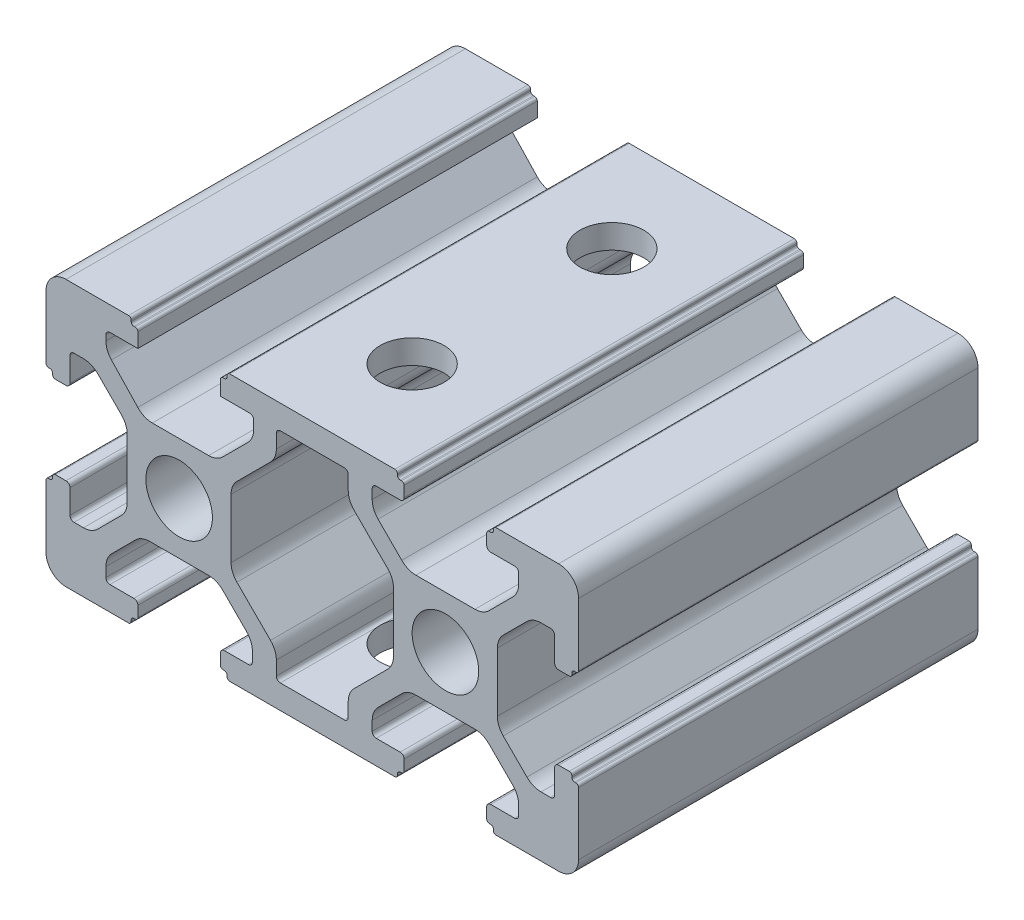
from build123d import *

# Parameters (mm, degrees)
SKETCH1_R           = 2.5
BOSS_EXTRUDE2_DEPTH = 30
SKETCH2_R           = 2.4
CUT_EXTRUDE1_DEPTH  = 28
SKETCH4_R           = 1.45
CUT_EXTRUDE2_DEPTH  = 70


with BuildPart() as part:
    # Sketch1 → Boss-Extrude2 (new body)
    with BuildSketch(Plane.XY):
        with BuildLine():
            Line((1.5, 0), (6.2, 0))
            ThreePointArc((6.2, 0), (6.341421356, 0.058578644), (6.4, 0.2))
            Line((6.4, 0.2), (6.4, 0.3))
            ThreePointArc((6.4, 0.3), (6.458578644, 0.441421356), (6.6, 0.5))
            Line((6.6, 0.5), (6.7, 0.5))
            ThreePointArc((6.7, 0.5), (6.841421356, 0.558578644), (6.9, 0.7))
            Line((6.9, 0.7), (6.9, 1.5))
            ThreePointArc((6.9, 1.5), (6.812132034, 1.712132034), (6.6, 1.8))
            Line((6.6, 1.8), (4.8, 1.8))
            ThreePointArc((4.8, 1.8), (4.587867966, 1.887867966), (4.5, 2.1))
            Line((4.5, 2.1), (4.5, 2.818019485))
            ThreePointArc((4.5, 2.818019485), (4.614180701, 3.392044633), (4.939339828, 3.878679656))
            Line((4.939339828, 3.878679656), (6.721320344, 5.660660172))
            ThreePointArc((6.721320344, 5.660660172), (7.207955367, 5.985819299), (7.781980515, 6.1))
            Line((7.781980515, 6.1), (12.218019485, 6.1))
            ThreePointArc((12.218019485, 6.1), (12.792044633, 5.985819299), (13.278679656, 5.660660172))
            Line((13.278679656, 5.660660172), (15.060660172, 3.878679656))
            ThreePointArc((15.060660172, 3.878679656), (15.385819299, 3.392044633), (15.5, 2.818019485))
            Line((15.5, 2.818019485), (15.5, 2.1))
            ThreePointArc((15.5, 2.1), (15.412132034, 1.887867966), (15.2, 1.8))
            Line((15.2, 1.8), (13.4, 1.8))
            ThreePointArc((13.4, 1.8), (13.187867966, 1.712132034), (13.1, 1.5))
            Line((13.1, 1.5), (13.1, 0.7))
            ThreePointArc((13.1, 0.7), (13.158578644, 0.558578644), (13.3, 0.5))
            Line((13.3, 0.5), (13.4, 0.5))
            ThreePointArc((13.4, 0.5), (13.541421356, 0.441421356), (13.6, 0.3))
            Line((13.6, 0.3), (13.6, 0.2))
            ThreePointArc((13.6, 0.2), (13.658578644, 0.058578644), (13.8, 0))
            Line((13.8, 0), (26.2, 0))
            ThreePointArc((26.2, 0), (26.341421356, 0.058578644), (26.4, 0.2))
            Line((26.4, 0.2), (26.4, 0.3))
            ThreePointArc((26.4, 0.3), (26.458578644, 0.441421356), (26.6, 0.5))
            Line((26.6, 0.5), (26.7, 0.5))
            ThreePointArc((26.7, 0.5), (26.841421356, 0.558578644), (26.9, 0.7))
            Line((26.9, 0.7), (26.9, 1.5))
            ThreePointArc((26.9, 1.5), (26.812132034, 1.712132034), (26.6, 1.8))
            Line((26.6, 1.8), (24.8, 1.8))
            ThreePointArc((24.8, 1.8), (24.587867966, 1.887867966), (24.5, 2.1))
            Line((24.5, 2.1), (24.5, 2.818019485))
            ThreePointArc((24.5, 2.818019485), (24.614180701, 3.392044633), (24.939339828, 3.878679656))
            Line((24.939339828, 3.878679656), (26.721320344, 5.660660172))
            ThreePointArc((26.721320344, 5.660660172), (27.207955367, 5.985819299), (27.781980515, 6.1))
            Line((27.781980515, 6.1), (32.218019485, 6.1))
            ThreePointArc((32.218019485, 6.1), (32.792044633, 5.985819299), (33.278679656, 5.660660172))
            Line((33.278679656, 5.660660172), (35.060660172, 3.878679656))
            ThreePointArc((35.060660172, 3.878679656), (35.385819299, 3.392044633), (35.5, 2.818019485))
            Line((35.5, 2.818019485), (35.5, 2.1))
            ThreePointArc((35.5, 2.1), (35.412132034, 1.887867966), (35.2, 1.8))
            Line((35.2, 1.8), (33.4, 1.8))
            ThreePointArc((33.4, 1.8), (33.187867966, 1.712132034), (33.1, 1.5))
            Line((33.1, 1.5), (33.1, 0.7))
            ThreePointArc((33.1, 0.7), (33.158578644, 0.558578644), (33.3, 0.5))
            Line((33.3, 0.5), (33.4, 0.5))
            ThreePointArc((33.4, 0.5), (33.541421356, 0.441421356), (33.6, 0.3))
            Line((33.6, 0.3), (33.6, 0.2))
            ThreePointArc((33.6, 0.2), (33.658578644, 0.058578644), (33.8, 0))
            Line((33.8, 0), (38.5, 0))
            ThreePointArc((38.5, 0), (39.560660172, 0.439339828), (40, 1.5))
            Line((40, 1.5), (40, 6.2))
            ThreePointArc((40, 6.2), (39.941421356, 6.341421356), (39.8, 6.4))
            Line((39.8, 6.4), (39.7, 6.4))
            ThreePointArc((39.7, 6.4), (39.558578644, 6.458578644), (39.5, 6.6))
            Line((39.5, 6.6), (39.5, 6.7))
            ThreePointArc((39.5, 6.7), (39.441421356, 6.841421356), (39.3, 6.9))
            Line((39.3, 6.9), (38.5, 6.9))
            ThreePointArc((38.5, 6.9), (38.287867966, 6.812132034), (38.2, 6.6))
            Line((38.2, 6.6), (38.2, 4.8))
            ThreePointArc((38.2, 4.8), (38.112132034, 4.587867966), (37.9, 4.5))
            Line((37.9, 4.5), (37.181980515, 4.5))
            ThreePointArc((37.181980515, 4.5), (36.607955367, 4.614180701), (36.121320344, 4.939339828))
            Line((36.121320344, 4.939339828), (34.339339828, 6.721320344))
            ThreePointArc((34.339339828, 6.721320344), (34.014180701, 7.207955367), (33.9, 7.781980515))
            Line((33.9, 7.781980515), (33.9, 12.218019485))
            ThreePointArc((33.9, 12.218019485), (34.014180701, 12.792044633), (34.339339828, 13.278679656))
            Line((34.339339828, 13.278679656), (36.121320344, 15.060660172))
            ThreePointArc((36.121320344, 15.060660172), (36.607955367, 15.385819299), (37.181980515, 15.5))
            Line((37.181980515, 15.5), (37.9, 15.5))
            ThreePointArc((37.9, 15.5), (38.112132034, 15.412132034), (38.2, 15.2))
            Line((38.2, 15.2), (38.2, 13.4))
            ThreePointArc((38.2, 13.4), (38.287867966, 13.187867966), (38.5, 13.1))
            Line((38.5, 13.1), (39.3, 13.1))
            ThreePointArc((39.3, 13.1), (39.441421356, 13.158578644), (39.5, 13.3))
            Line((39.5, 13.3), (39.5, 13.4))
            ThreePointArc((39.5, 13.4), (39.558578644, 13.541421356), (39.7, 13.6))
            Line((39.7, 13.6), (39.8, 13.6))
            ThreePointArc((39.8, 13.6), (39.941421356, 13.658578644), (40, 13.8))
            Line((40, 13.8), (40, 18.5))
            ThreePointArc((40, 18.5), (39.560660172, 19.560660172), (38.5, 20))
            Line((38.5, 20), (33.8, 20))
            ThreePointArc((33.8, 20), (33.658578644, 19.941421356), (33.6, 19.8))
            Line((33.6, 19.8), (33.6, 19.7))
            ThreePointArc((33.6, 19.7), (33.541421356, 19.558578644), (33.4, 19.5))
            Line((33.4, 19.5), (33.3, 19.5))
            ThreePointArc((33.3, 19.5), (33.158578644, 19.441421356), (33.1, 19.3))
            Line((33.1, 19.3), (33.1, 18.5))
            ThreePointArc((33.1, 18.5), (33.187867966, 18.287867966), (33.4, 18.2))
            Line((33.4, 18.2), (35.2, 18.2))
            ThreePointArc((35.2, 18.2), (35.412132034, 18.112132034), (35.5, 17.9))
            Line((35.5, 17.9), (35.5, 17.181980515))
            ThreePointArc((35.5, 17.181980515), (35.385819299, 16.607955367), (35.060660172, 16.121320344))
            Line((35.060660172, 16.121320344), (33.278679656, 14.339339828))
            ThreePointArc((33.278679656, 14.339339828), (32.792044633, 14.014180701), (32.218019485, 13.9))
            Line((32.218019485, 13.9), (27.781980515, 13.9))
            ThreePointArc((27.781980515, 13.9), (27.207955367, 14.014180701), (26.721320344, 14.339339828))
            Line((26.721320344, 14.339339828), (24.939339828, 16.121320344))
            ThreePointArc((24.939339828, 16.121320344), (24.614180701, 16.607955367), (24.5, 17.181980515))
            Line((24.5, 17.181980515), (24.5, 17.9))
            ThreePointArc((24.5, 17.9), (24.587867966, 18.112132034), (24.8, 18.2))
            Line((24.8, 18.2), (26.6, 18.2))
            ThreePointArc((26.6, 18.2), (26.812132034, 18.287867966), (26.9, 18.5))
            Line((26.9, 18.5), (26.9, 19.3))
            ThreePointArc((26.9, 19.3), (26.841421356, 19.441421356), (26.7, 19.5))
            Line((26.7, 19.5), (26.6, 19.5))
            ThreePointArc((26.6, 19.5), (26.458578644, 19.558578644), (26.4, 19.7))
            Line((26.4, 19.7), (26.4, 19.8))
            ThreePointArc((26.4, 19.8), (26.341421356, 19.941421356), (26.2, 20))
            Line((26.2, 20), (13.8, 20))
            ThreePointArc((13.8, 20), (13.658578644, 19.941421356), (13.6, 19.8))
            Line((13.6, 19.8), (13.6, 19.7))
            ThreePointArc((13.6, 19.7), (13.541421356, 19.558578644), (13.4, 19.5))
            Line((13.4, 19.5), (13.3, 19.5))
            ThreePointArc((13.3, 19.5), (13.158578644, 19.441421356), (13.1, 19.3))
            Line((13.1, 19.3), (13.1, 18.2))
            Line((13.1, 18.2), (15.3, 18.2))
            ThreePointArc((15.3, 18.2), (15.512132034, 18.112132034), (15.6, 17.9))
            Line((15.6, 17.9), (15.6, 17.281980515))
            ThreePointArc((15.6, 17.281980515), (15.485819299, 16.707955367), (15.160660172, 16.221320344))
            Line((15.160660172, 16.221320344), (13.278679656, 14.339339828))
            ThreePointArc((13.278679656, 14.339339828), (12.792044633, 14.014180701), (12.218019485, 13.9))
            Line((12.218019485, 13.9), (7.986375635, 13.9))
            ThreePointArc((7.986375635, 13.9), (7.393381044, 14.022191082), (6.896997987, 14.36885678))
            Line((6.896997987, 14.36885678), (4.910622352, 16.467414163))
            ThreePointArc((4.910622352, 16.467414163), (4.606431474, 16.943609851), (4.5, 17.498557383))
            Line((4.5, 17.498557383), (4.5, 17.9))
            ThreePointArc((4.5, 17.9), (4.587867966, 18.112132034), (4.8, 18.2))
            Line((4.8, 18.2), (6.9, 18.2))
            Line((6.9, 18.2), (6.9, 19.3))
            ThreePointArc((6.9, 19.3), (6.841421356, 19.441421356), (6.7, 19.5))
            Line((6.7, 19.5), (6.6, 19.5))
            ThreePointArc((6.6, 19.5), (6.458578644, 19.558578644), (6.4, 19.7))
            Line((6.4, 19.7), (6.4, 19.8))
            ThreePointArc((6.4, 19.8), (6.341421356, 19.941421356), (6.2, 20))
            Line((6.2, 20), (1.5, 20))
            ThreePointArc((1.5, 20), (0.439339828, 19.560660172), (0, 18.5))
            Line((0, 18.5), (0, 13.8))
            ThreePointArc((0, 13.8), (0.058578644, 13.658578644), (0.2, 13.6))
            Line((0.2, 13.6), (0.3, 13.6))
            ThreePointArc((0.3, 13.6), (0.441421356, 13.541421356), (0.5, 13.4))
            Line((0.5, 13.4), (0.5, 13.3))
            ThreePointArc((0.5, 13.3), (0.558578644, 13.158578644), (0.7, 13.1))
            Line((0.7, 13.1), (1.5, 13.1))
            ThreePointArc((1.5, 13.1), (1.712132034, 13.187867966), (1.8, 13.4))
            Line((1.8, 13.4), (1.8, 15.2))
            ThreePointArc((1.8, 15.2), (1.887867966, 15.412132034), (2.1, 15.5))
            Line((2.1, 15.5), (2.818019485, 15.5))
            ThreePointArc((2.818019485, 15.5), (3.392044633, 15.385819299), (3.878679656, 15.060660172))
            Line((3.878679656, 15.060660172), (5.660660172, 13.278679656))
            ThreePointArc((5.660660172, 13.278679656), (5.985819299, 12.792044633), (6.1, 12.218019485))
            Line((6.1, 12.218019485), (6.1, 7.781980515))
            ThreePointArc((6.1, 7.781980515), (5.985819299, 7.207955367), (5.660660172, 6.721320344))
            Line((5.660660172, 6.721320344), (3.878679656, 4.939339828))
            ThreePointArc((3.878679656, 4.939339828), (3.392044633, 4.614180701), (2.818019485, 4.5))
            Line((2.818019485, 4.5), (2.1, 4.5))
            ThreePointArc((2.1, 4.5), (1.887867966, 4.587867966), (1.8, 4.8))
            Line((1.8, 4.8), (1.8, 6.6))
            ThreePointArc((1.8, 6.6), (1.712132034, 6.812132034), (1.5, 6.9))
            Line((1.5, 6.9), (0.7, 6.9))
            ThreePointArc((0.7, 6.9), (0.558578644, 6.841421356), (0.5, 6.7))
            Line((0.5, 6.7), (0.5, 6.6))
            ThreePointArc((0.5, 6.6), (0.441421356, 6.458578644), (0.3, 6.4))
            Line((0.3, 6.4), (0.2, 6.4))
            ThreePointArc((0.2, 6.4), (0.058578644, 6.341421356), (0, 6.2))
            Line((0, 6.2), (0, 1.5))
            ThreePointArc((0, 1.5), (0.439339828, 0.439339828), (1.5, 0))
        make_face()
        with Locations((10, 10)):
            Circle(SKETCH1_R, mode=Mode.SUBTRACT)
        with Locations((30, 10)):
            Circle(SKETCH1_R, mode=Mode.SUBTRACT)
        with BuildLine():
            Line((17.6, 1.8), (22.4, 1.8))
            ThreePointArc((22.4, 1.8), (22.612132034, 1.887867966), (22.7, 2.1))
            Line((22.7, 2.1), (22.7, 3.139339828))
            ThreePointArc((22.7, 3.139339828), (22.814180701, 3.713364977), (23.139339828, 4.2))
            Line((23.139339828, 4.2), (25.660660172, 6.721320344))
            ThreePointArc((25.660660172, 6.721320344), (25.985819299, 7.207955367), (26.1, 7.781980515))
            Line((26.1, 7.781980515), (26.1, 12.218019485))
            ThreePointArc((26.1, 12.218019485), (25.985819299, 12.792044633), (25.660660172, 13.278679656))
            Line((25.660660172, 13.278679656), (23.139339828, 15.8))
            ThreePointArc((23.139339828, 15.8), (22.814180701, 16.286635023), (22.7, 16.860660172))
            Line((22.7, 16.860660172), (22.7, 17.9))
            ThreePointArc((22.7, 17.9), (22.612132034, 18.112132034), (22.4, 18.2))
            Line((22.4, 18.2), (17.6, 18.2))
            ThreePointArc((17.6, 18.2), (17.387867966, 18.112132034), (17.3, 17.9))
            Line((17.3, 17.9), (17.3, 16.860660172))
            ThreePointArc((17.3, 16.860660172), (17.185819299, 16.286635023), (16.860660172, 15.8))
            Line((16.860660172, 15.8), (14.339339828, 13.278679656))
            ThreePointArc((14.339339828, 13.278679656), (14.014180701, 12.792044633), (13.9, 12.218019485))
            Line((13.9, 12.218019485), (13.9, 7.781980515))
            ThreePointArc((13.9, 7.781980515), (14.014180701, 7.207955367), (14.339339828, 6.721320344))
            Line((14.339339828, 6.721320344), (16.860660172, 4.2))
            ThreePointArc((16.860660172, 4.2), (17.185819299, 3.713364977), (17.3, 3.139339828))
            Line((17.3, 3.139339828), (17.3, 2.1))
            ThreePointArc((17.3, 2.1), (17.387867966, 1.887867966), (17.6, 1.8))
        make_face(mode=Mode.SUBTRACT)
    extrude(amount=BOSS_EXTRUDE2_DEPTH)

    # Sketch2 → Cut-Extrude1 (cut)
    with BuildSketch(Plane(origin=(0, 20, 0), x_dir=(1, 0, 0), z_dir=(0, 1, 0))):
        with Locations(Location((20, -7.5, 0), (0, 0, 180))):
            Circle(SKETCH2_R)
        with Locations(Location((20, -22.5, 0), (0, 0, 180))):
            Circle(SKETCH2_R)
    extrude(amount=-CUT_EXTRUDE1_DEPTH, mode=Mode.SUBTRACT)

    # Sketch4 → Cut-Extrude2 (cut)
    with BuildSketch(Plane.ZY.offset(-6.1)):
        with Locations((17, 10)):
            Circle(SKETCH4_R)
    extrude(amount=-CUT_EXTRUDE2_DEPTH, mode=Mode.SUBTRACT)


solid = part.part
